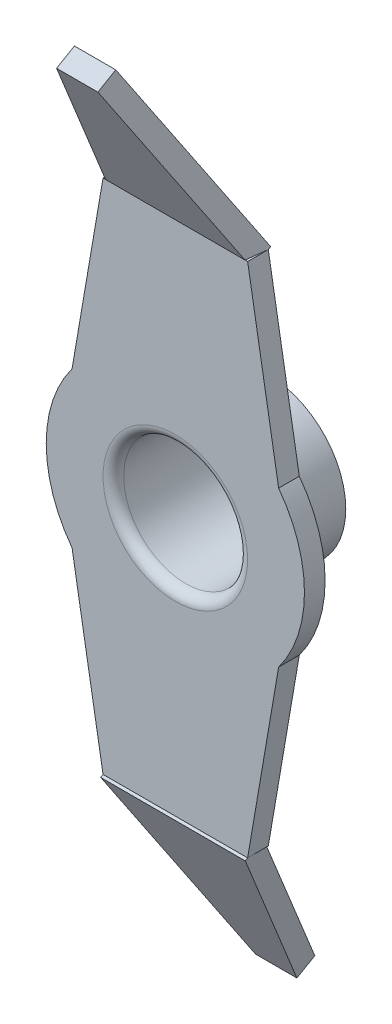
from build123d import *

# Parameters (mm, degrees)
ESQUISSE1_R          = 7.5
ESQUISSE1_R_2        = 6
BASE_EXTRUSION_DEPTH = 7
ESQUISSE2_R          = 6
BOSS_EXTRU_1_DEPTH   = 2
CONG_1_R             = 1
BOSS_EXTRU_2_DEPTH   = 2
BOSS_EXTRU_3_DEPTH   = 2


with BuildPart() as part:
    # Esquisse1 → Base-Extrusion (new body)
    with BuildSketch(Plane.XY):
        Circle(ESQUISSE1_R)
        Circle(ESQUISSE1_R_2, mode=Mode.SUBTRACT)
    extrude(amount=BASE_EXTRUSION_DEPTH)

    # Esquisse2 → Boss.-Extru.1 (add)
    with BuildSketch(Plane.XY.offset(7)):
        with BuildLine():
            Line((-7, 25), (7, 25))
            Line((7, 25), (10, 7.5))
            ThreePointArc((10, 7.5), (12.5, 0), (10, -7.5))
            Line((10, -7.5), (7, -25))
            Line((7, -25), (-7, -25))
            Line((-7, -25), (-10, -7.5))
            ThreePointArc((-10, -7.5), (-12.5, 0), (-10, 7.5))
            Line((-10, 7.5), (-7, 25))
        make_face()
        Circle(ESQUISSE2_R, mode=Mode.SUBTRACT)
    extrude(amount=BOSS_EXTRU_1_DEPTH)

    # Congé1
    cong_1_edges = [part.edges().sort_by_distance(p)[0] for p in [
        (-6, 0, 9),
    ]]
    fillet(cong_1_edges, radius=CONG_1_R)

    # Esquisse3 → Boss.-Extru.2 (add)
    with BuildSketch(Plane(origin=(0, 2.352885683, -4.075317547), x_dir=(-1, 0, 0), z_dir=(0, 0.499999999999998, -0.8660254037844398))):
        Polygon((-7, 25.150635095), (-2, 45.150635095), (2, 45.150635095), (7, 25.150635095), align=None)
    extrude(amount=BOSS_EXTRU_2_DEPTH)

    # Esquisse4 → Boss.-Extru.3 (add)
    with BuildSketch(Plane(origin=(0, -9.281088913, 16.075317547), x_dir=(1, 0, 0), z_dir=(0, -0.49999999999999806, 0.8660254037844398))):
        Polygon((-7, -17.150635095), (7, -17.150635095), (2, -37.150635095), (-2, -37.150635095), align=None)
    extrude(amount=BOSS_EXTRU_3_DEPTH)


solid = part.part
